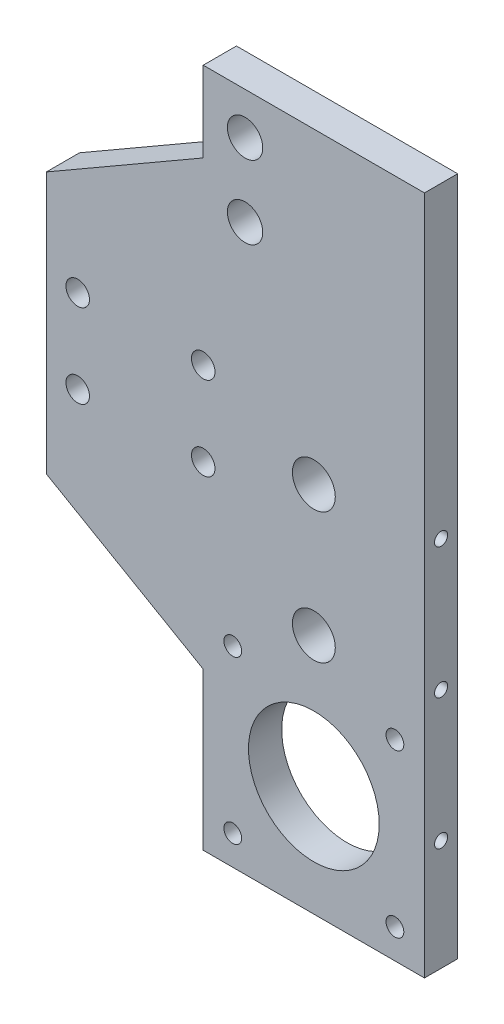
from build123d import *

# Parameters (mm, degrees)
SKETCH2_W                       = 42.3
SKETCH2_H                       = 130
SKETCH2_R                       = 12.5
SKETCH2_R_2                     = 4.1
BOSS_EXTRUDE1_DEPTH             = 6.35
TAP_DRILL_FOR_M3X0_5_TAP1_D     = 2.5
TAP_DRILL_FOR_M3X0_5_TAP1_DEPTH = 21.15
TAP_DRILL_FOR_M3X0_5_TAP1_TIP   = 0.751075774
M3_CLEARANCE_HOLE1_D            = 3.4
F_1_4_CLEARANCE_HOLE1_D         = 6.7564
BOSS_EXTRUDE2_DEPTH             = 6.35
M4_CLEARANCE_HOLE1_D            = 4.5


with BuildPart() as part:
    # Sketch2 → Boss-Extrude1 (new body)
    with BuildSketch(Plane.XY):
        with Locations((0, 43.85)):
            Rectangle(SKETCH2_W, SKETCH2_H)
        Circle(SKETCH2_R, mode=Mode.SUBTRACT)
        with Locations((0, 25)):
            Circle(SKETCH2_R_2, mode=Mode.SUBTRACT)
        with Locations((0, 50)):
            Circle(SKETCH2_R_2, mode=Mode.SUBTRACT)
    extrude(amount=BOSS_EXTRUDE1_DEPTH)

    # Tap Drill for M3x0.5 Tap1
    with Locations(Plane(origin=(21.15, 0, 0), x_dir=(0, 0, 1), z_dir=(1, 0, 0))):
        with Locations((3.175, -50), (3.175, 0), (3.175, -25)):
            Hole(TAP_DRILL_FOR_M3X0_5_TAP1_D / 2, depth=TAP_DRILL_FOR_M3X0_5_TAP1_DEPTH)
            with Locations((0, 0, -(TAP_DRILL_FOR_M3X0_5_TAP1_DEPTH + TAP_DRILL_FOR_M3X0_5_TAP1_TIP / 2))):  # 118° drill point
                Cone(0, TAP_DRILL_FOR_M3X0_5_TAP1_D / 2, TAP_DRILL_FOR_M3X0_5_TAP1_TIP, mode=Mode.SUBTRACT)

    # M3 Clearance Hole1 (through all)
    with Locations(Plane.XY.offset(6.35)):
        with Locations((-15.5, 15.5), (-15.5, -15.5), (15.5, -15.5), (15.5, 15.5)):
            Hole(M3_CLEARANCE_HOLE1_D / 2)

    # 1/4 Clearance Hole1 (through all)
    with Locations(Plane.XY.offset(6.35)):
        with Locations((-13.15, 86.85), (-13.15, 100.85)):
            Hole(F_1_4_CLEARANCE_HOLE1_D / 2)

    # Sketch13 → Boss-Extrude2 (add)
    with BuildSketch(Plane.XY.offset(6.35)):
        Polygon((-21.15, 8.85), (-51.15, 26.170508076), (-51.15, 76.170508076), (-21.15, 93.491016151), align=None)
    extrude(amount=-BOSS_EXTRUDE2_DEPTH)

    # M4 Clearance Hole1 (through all)
    with Locations(Plane.XY.offset(6.35)):
        with Locations((-45.15, 59.170508076), (-21.15, 59.170508076), (-21.15, 43.170508076), (-45.15, 43.170508076)):
            Hole(M4_CLEARANCE_HOLE1_D / 2)


solid = part.part
